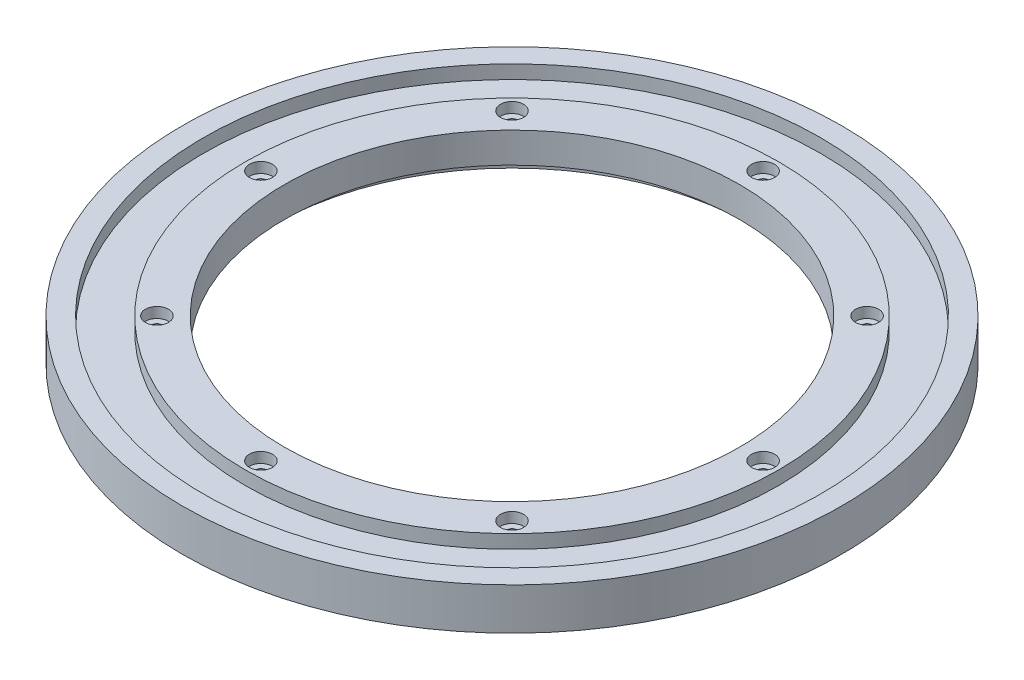
from build123d import *

# Parameters (mm, degrees)
SKETCH4_R          = 5
CUT_EXTRUDE1_DEPTH = 448.269493706
SKETCH5_R          = 11
CUT_EXTRUDE2_DEPTH = 10


with BuildPart() as part:
    # Sketch3 → Revolve1 (revolve)
    with BuildSketch(Plane(origin=(0, 0, 0), x_dir=(0, 0, -1), z_dir=(1, 0, 0)), mode=Mode.PRIVATE) as revolve1_sk:
        Polygon((-315, 34.712328767), (-295, 34.712328767), (-295, 21.712328767), (-255, 21.712328767), (-255, 34.712328767), (-217.5, 34.712328767), (-217.5, 5.712328767), (-229.5, 5.712328767), (-229.5, -5.287671233), (-315, -5.287671233), align=None)
    revolve(revolve1_sk.sketch.rotate(Axis((0, -1465.136435986, 0), (0, 1, 0)), 180), axis=Axis((0, -1465.136435986, 0), (0, 1, 0)))

    # Sketch4 → Cut-Extrude1 (cut, through all)
    with BuildSketch(Plane(origin=(0, 34.712328767, 0), x_dir=(1, 0, 0), z_dir=(0, 1, 0))):
        with Locations(Location((0, 240, 0), (0, 0, 270))):
            Circle(SKETCH4_R)
        with Locations(Location((169.705627485, 169.705627485, 0), (0, 0, 270))):
            Circle(SKETCH4_R)
        with Locations(Location((240, 0, 0), (0, 0, 270))):
            Circle(SKETCH4_R)
        with Locations(Location((169.705627485, -169.705627485, 0), (0, 0, 270))):
            Circle(SKETCH4_R)
        with Locations(Location((0, -240, 0), (0, 0, 270))):
            Circle(SKETCH4_R)
        with Locations(Location((-169.705627485, -169.705627485, 0), (0, 0, 270))):
            Circle(SKETCH4_R)
        with Locations(Location((-240, 0, 0), (0, 0, 270))):
            Circle(SKETCH4_R)
        with Locations(Location((-169.705627485, 169.705627485, 0), (0, 0, 270))):
            Circle(SKETCH4_R)
    extrude(amount=-CUT_EXTRUDE1_DEPTH, mode=Mode.SUBTRACT)

    # Sketch5 → Cut-Extrude2 (cut)
    with BuildSketch(Plane(origin=(0, 34.712328767, 0), x_dir=(1, 0, 0), z_dir=(0, 1, 0))):
        with Locations(Location((0, 240, 0), (0, 0, 270))):
            Circle(SKETCH5_R)
        with Locations(Location((169.705627485, 169.705627485, 0), (0, 0, 270))):
            Circle(SKETCH5_R)
        with Locations(Location((240, 0, 0), (0, 0, 270))):
            Circle(SKETCH5_R)
        with Locations(Location((169.705627485, -169.705627485, 0), (0, 0, 270))):
            Circle(SKETCH5_R)
        with Locations(Location((0, -240, 0), (0, 0, 270))):
            Circle(SKETCH5_R)
        with Locations(Location((-169.705627485, -169.705627485, 0), (0, 0, 270))):
            Circle(SKETCH5_R)
        with Locations(Location((-240, 0, 0), (0, 0, 270))):
            Circle(SKETCH5_R)
        with Locations(Location((-169.705627485, 169.705627485, 0), (0, 0, 270))):
            Circle(SKETCH5_R)
    extrude(amount=-CUT_EXTRUDE2_DEPTH, mode=Mode.SUBTRACT)


solid = part.part
